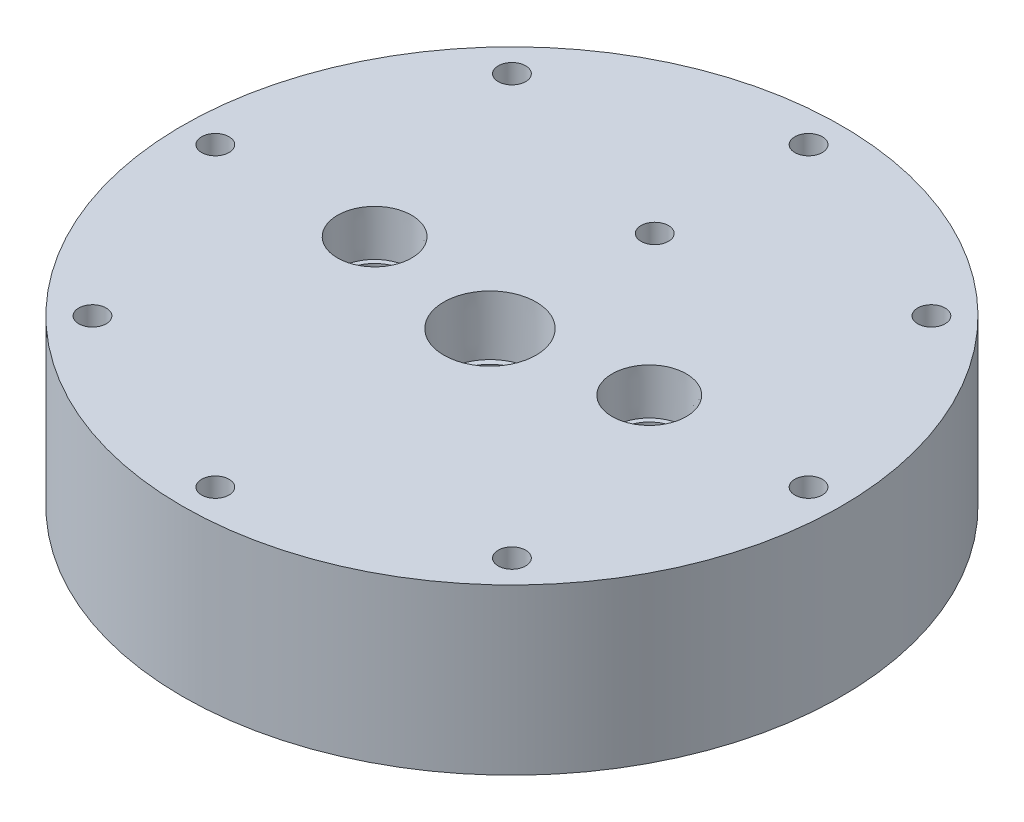
from build123d import *

# Parameters (mm, degrees)
SKETCH1_R                                      = 76.2
BILLET_DEPTH                                   = 50.8
SKETCH3_R                                      = 19.05
LOX_PLATE_DEPTH                                = 13.97
SKETCH5_R                                      = 13.97
LOX_DOME_DEPTH                                 = 20.32
SKETCH7_R                                      = 76.2
TOP_MILL_DEPTH                                 = 12.7
F_1_4_BOLT_HOLE_REACH                          = 116.3
SKETCH11_R                                     = 3.175
BOLT_PATTERN_COUNT                             = 8
SKETCH12_R                                     = 60.96
KEROSENE_PLATE_DEPTH                           = 10.16
KEROSENE_INLET_3_8_NPT_TAPPED_HOLE1_AT_2_COUNT = 2
KEROSENE_INLET_3_8_NPT_TAPPED_HOLE1_AT_2_PITCH = 63.5
MANIFOLD_HOLE_REACH                            = 121.137
SKETCH14_R                                     = 3.175
SKETCH15_R                                     = 8.89
SKETCH15_R_2                                   = 7.62
MANIFOLD_SEAL_DEPTH                            = 1.27
SKETCH26_R                                     = 17.78
SKETCH26_R_2                                   = 16.51
LOX_PLATE_O_RING_DEPTH                         = 1.27


with BuildPart() as part:
    # Sketch1 → Billet (new body)
    with BuildSketch(Plane(origin=(0, 0, 0), x_dir=(1, 0, 0), z_dir=(0, 1, 0))):
        Circle(SKETCH1_R)
    extrude(amount=-BILLET_DEPTH)

    # Sketch3 → Lox Plate (cut)
    with BuildSketch(Plane(origin=(0, -50.8, 0), x_dir=(1, 0, 0), z_dir=(0, 1, 0))):
        Circle(SKETCH3_R)
    extrude(amount=LOX_PLATE_DEPTH, mode=Mode.SUBTRACT)

    # Sketch5 → Lox Dome (cut)
    with BuildSketch(Plane(origin=(0, -50.8, 0), x_dir=(1, 0, 0), z_dir=(0, 1, 0))):
        Circle(SKETCH5_R)
    extrude(amount=LOX_DOME_DEPTH, mode=Mode.SUBTRACT)

    # Sketch7 → Top Mill (cut)
    with BuildSketch(Plane(origin=(0, 0, 0), x_dir=(1, 0, 0), z_dir=(0, 1, 0))):
        Circle(SKETCH7_R)
    extrude(amount=-TOP_MILL_DEPTH, mode=Mode.SUBTRACT)

    # Sketch11 → 1/4" Bolt Hole (cut, up to next)
    with BuildSketch(Plane(origin=(0, -50.8, 0), x_dir=(1, 0, 0), z_dir=(0, 1, 0)), mode=Mode.PRIVATE) as f_1_4_bolt_hole_sk1:
        with Locations((0, 68.58)):
            Circle(SKETCH11_R)
    f_1_4_bolt_hole_tool1 = extrude(f_1_4_bolt_hole_sk1.sketch, amount=F_1_4_BOLT_HOLE_REACH, mode=Mode.PRIVATE) & part.part
    f_1_4_bolt_hole = f_1_4_bolt_hole_tool1.solids().sort_by_distance((0, -50.8, -68.58))[0]
    add(f_1_4_bolt_hole, mode=Mode.SUBTRACT)

    # Bolt Pattern: 1/4" Bolt Hole ×8 about axis
    bolt_pattern_axis = Axis((0, 53.34, 0), (0, -1, 0))
    for i in range(1, BOLT_PATTERN_COUNT):
        add(f_1_4_bolt_hole.rotate(bolt_pattern_axis, i * 360 / BOLT_PATTERN_COUNT), mode=Mode.SUBTRACT)

    # Sketch12 → Kerosene Plate (cut)
    with BuildSketch(Plane(origin=(0, -50.8, 0), x_dir=(1, 0, 0), z_dir=(0, 1, 0))):
        Circle(SKETCH12_R)
    extrude(amount=KEROSENE_PLATE_DEPTH, mode=Mode.SUBTRACT)

    # Sketch21 → Lox Inlet-1/2 NPT Tapped Hole3 (revolve, cut)
    with BuildSketch(Plane(origin=(0, -12.7, 5.08), x_dir=(0, 0, 1), z_dir=(1, 0, 0))):
        Polygon((0, 0), (0, 38.1), (8.9281, 38.1), (8.9281, 13.462), (10.261665792, 13.462), (10.6647361, 0), align=None)
    revolve(axis=Axis((0, -6.35, 5.08), (0, -1, 0)), mode=Mode.SUBTRACT)

    # Sketch25 → Kerosene Inlet-3/8 NPT Tapped Hole1 (revolve, cut)
    with BuildSketch(Plane(origin=(-31.75, -12.7, 0), x_dir=(0, 0, 1), z_dir=(1, 0, 0))):
        Polygon((0, 0), (0, 38.1), (7.1374, 38.1), (7.1374, 10.414), (8.263205494, 10.414), (8.5750146, 0), align=None)
    kerosene_inlet_3_8_npt_tapped_hole1 = revolve(axis=Axis((-31.75, -6.35, 0), (0, -1, 0)), mode=Mode.SUBTRACT)

    # Kerosene Inlet-3/8 NPT Tapped Hole1 at 2: Kerosene Inlet-3/8 NPT Tapped Hole1 ×2
    with Locations(*[(i * KEROSENE_INLET_3_8_NPT_TAPPED_HOLE1_AT_2_PITCH, 0, 0) for i in range(1, KEROSENE_INLET_3_8_NPT_TAPPED_HOLE1_AT_2_COUNT)]):
        add(kerosene_inlet_3_8_npt_tapped_hole1, mode=Mode.SUBTRACT)

    # Sketch14 → Manifold hole (cut, up to next)
    with BuildSketch(Plane(origin=(0, 0, 0), x_dir=(1, 0, 0), z_dir=(0, 1, 0)), mode=Mode.PRIVATE) as manifold_hole_sk1:
        with Locations((0, 33.02)):
            Circle(SKETCH14_R)
    manifold_hole_tool1 = extrude(manifold_hole_sk1.sketch, amount=-MANIFOLD_HOLE_REACH, mode=Mode.PRIVATE) & part.part
    add(manifold_hole_tool1.solids().sort_by_distance((0, 0, -33.02))[0], mode=Mode.SUBTRACT)

    # Sketch15 → Manifold seal (cut)
    with BuildSketch(Plane(origin=(0, -40.64, 0), x_dir=(1, 0, 0), z_dir=(0, 1, 0))):
        with Locations((0, 33.02)):
            Circle(SKETCH15_R)
        with Locations((0, 33.02)):
            Circle(SKETCH15_R_2, mode=Mode.SUBTRACT)
    extrude(amount=MANIFOLD_SEAL_DEPTH, mode=Mode.SUBTRACT)

    # Sketch26 → Lox Plate O Ring (cut)
    with BuildSketch(Plane.XZ.offset(36.83)):
        Circle(SKETCH26_R)
        Circle(SKETCH26_R_2, mode=Mode.SUBTRACT)
    extrude(amount=-LOX_PLATE_O_RING_DEPTH, mode=Mode.SUBTRACT)


solid = part.part
